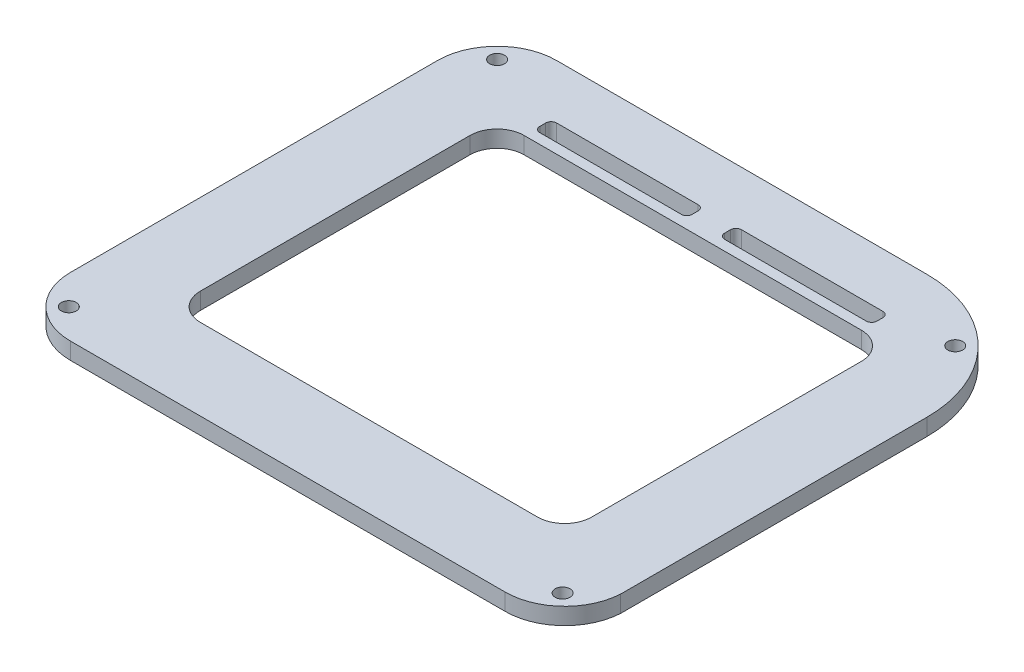
from build123d import *

# Parameters (mm, degrees)
SKETCH1_R           = 1.375
BOSS_EXTRUDE1_DEPTH = 3.1


with BuildPart() as part:
    # Sketch1 → Boss-Extrude1 (new body)
    with BuildSketch(Plane(origin=(0, 0, 0), x_dir=(1, 0, 0), z_dir=(0, 1, 0))):
        with BuildLine():
            Line((-39.71074184, 45.601377345), (28.739257907, 45.601389398))
            ThreePointArc((28.739257907, 45.601389398), (44.917862085, 38.899993272), (51.619259514, 22.721389634))
            Line((51.619259514, 22.721389634), (51.619259514, -33.910586665))
            ThreePointArc((51.619259514, -33.910586665), (48.176660713, -41.25083682), (40.639819253, -44.238608506))
            Line((40.639819253, -44.238608506), (-39.71072563, -44.238622655))
            ThreePointArc((-39.71072563, -44.238622655), (-47.488919901, -41.016788494), (-50.710740093, -33.238588436))
            Line((-50.710740093, -33.238588436), (-50.710740093, 34.601411853))
            ThreePointArc((-50.710740093, 34.601411853), (-47.48890491, 42.379565328), (-39.71074184, 45.601377345))
        make_face()
        with Locations(Location((-45.367589881, 40.25824398, 0), (0, 0, 90))):
            Circle(SKETCH1_R, mode=Mode.SUBTRACT)
        with Locations(Location((-45.367595522, -38.895467925, 0), (0, 0, 90))):
            Circle(SKETCH1_R, mode=Mode.SUBTRACT)
        with Locations(Location((46.094055761, -39.090799779, 0), (0, 0, 90))):
            Circle(SKETCH1_R, mode=Mode.SUBTRACT)
        with Locations(Location((42.796541827, 36.778672843, 0), (0, 0, 90))):
            Circle(SKETCH1_R, mode=Mode.SUBTRACT)
        with BuildLine():
            Line((36.619259514, -24.238609214), (36.619259514, 25.60137805))
            ThreePointArc((36.619259514, 25.60137805), (35.15479342, 29.136911955), (31.619259514, 30.60137805))
            Line((31.619259514, 30.60137805), (-30.710740093, 30.60137805))
            ThreePointArc((-30.710740093, 30.60137805), (-34.246273999, 29.136911955), (-35.710740093, 25.60137805))
            Line((-35.710740093, 25.60137805), (-35.710740093, -24.238609214))
            ThreePointArc((-35.710740093, -24.238609214), (-34.246273999, -27.77414312), (-30.710740093, -29.238609214))
            Line((-30.710740093, -29.238609214), (31.619259514, -29.238609214))
            ThreePointArc((31.619259514, -29.238609214), (35.15479342, -27.77414312), (36.619259514, -24.238609214))
        make_face(mode=Mode.SUBTRACT)
        with BuildLine():
            Line((4.454259711, 35.60137805), (30.619259514, 35.60137805))
            ThreePointArc((30.619259514, 35.60137805), (31.326366295, 35.308484831), (31.619259514, 34.60137805))
            Line((31.619259514, 34.60137805), (31.619259514, 33.50137805))
            ThreePointArc((31.619259514, 33.50137805), (31.326366295, 32.794271268), (30.619259514, 32.50137805))
            Line((30.619259514, 32.50137805), (4.454259711, 32.50137805))
            ThreePointArc((4.454259711, 32.50137805), (3.747152929, 32.794271268), (3.454259711, 33.50137805))
            Line((3.454259711, 33.50137805), (3.454259711, 34.60137805))
            ThreePointArc((3.454259711, 34.60137805), (3.747152929, 35.308484831), (4.454259711, 35.60137805))
        make_face(mode=Mode.SUBTRACT)
        with BuildLine():
            Line((-29.710740093, 35.60137805), (-3.545740289, 35.60137805))
            ThreePointArc((-3.545740289, 35.60137805), (-2.838633508, 35.308484831), (-2.545740289, 34.60137805))
            Line((-2.545740289, 34.60137805), (-2.545740289, 33.50137805))
            ThreePointArc((-2.545740289, 33.50137805), (-2.838633508, 32.794271268), (-3.545740289, 32.50137805))
            Line((-3.545740289, 32.50137805), (-29.710740093, 32.50137805))
            ThreePointArc((-29.710740093, 32.50137805), (-30.417846874, 32.794271268), (-30.710740093, 33.50137805))
            Line((-30.710740093, 33.50137805), (-30.710740093, 34.60137805))
            ThreePointArc((-30.710740093, 34.60137805), (-30.417846874, 35.308484831), (-29.710740093, 35.60137805))
        make_face(mode=Mode.SUBTRACT)
    extrude(amount=BOSS_EXTRUDE1_DEPTH)


solid = part.part
